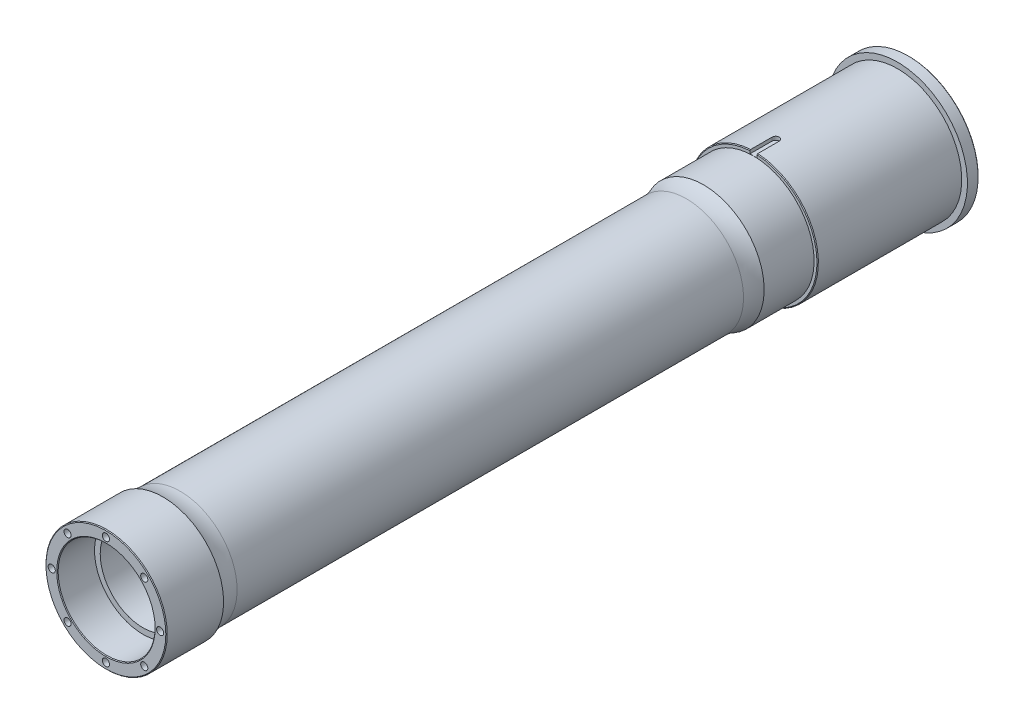
from build123d import *

# Parameters (mm, degrees)
SKETCH_3_R          = 2.5
CUT_EXTRUDE_1_DEPTH = 15
CUT_EXTRUDE_START   = -15
SKETCH_4_R          = 2.5
CUT_EXTRUDE_2_DEPTH = 15
CHAMFER_1_SIZE      = 0.5
CUT_EXTRUDE_3_DEPTH = 15


with BuildPart() as part:
    # 草图1 → 旋转1 (revolve)
    with BuildSketch(Plane(origin=(0, 0, 0), x_dir=(0, 0, -1), z_dir=(1, 0, 0)), mode=Mode.PRIVATE) as revolve_1_sk:
        with BuildLine():
            Line((0, 0), (0, 42.5))
            Line((0, 42.5), (40, 42.5))
            ThreePointArc((40, 42.5), (45.865854451, 40.631649689), (51.989578808, 40))
            Line((51.989578808, 40), (407.010421192, 40))
            ThreePointArc((407.010421192, 40), (413.134145549, 40.631649689), (419, 42.5))
            Line((419, 42.5), (454, 42.5))
            Line((454, 42.5), (454, 45))
            Line((454, 45), (555, 45))
            Line((555, 45), (555, 49))
            Line((555, 49), (563, 49))
            Line((563, 49), (563, 0))
            Line((563, 0), (0, 0))
        make_face()
    revolve(revolve_1_sk.sketch.rotate(Axis((0, 0, 0), (0, 0, 1)), 90), axis=Axis((0, 0, 0), (0, 0, 1)))

    # 草图2 → 切除-旋转1 (revolve, cut)
    with BuildSketch(Plane(origin=(0, 0, 0), x_dir=(0, 0, -1), z_dir=(1, 0, 0)), mode=Mode.PRIVATE) as cut_revolve_1_sk:
        Polygon((0, 0), (0, 34), (26, 34), (26, 30), (537, 30), (537, 34), (563, 34), (563, 0), align=None)
    revolve(cut_revolve_1_sk.sketch.rotate(Axis((0, 0, 0), (0, 0, 1)), 90), axis=Axis((0, 0, 0), (0, 0, 1)), mode=Mode.SUBTRACT)

    # 草图3 → 切除-拉伸1 (cut)
    with BuildSketch(Plane.XY):
        with Locations((0, 38)):
            Circle(SKETCH_3_R)
        with Locations((26.870057685, 26.870057685)):
            Circle(SKETCH_3_R)
        with Locations((38, 0)):
            Circle(SKETCH_3_R)
        with Locations((26.870057685, -26.870057685)):
            Circle(SKETCH_3_R)
        with Locations((0, -38)):
            Circle(SKETCH_3_R)
        with Locations((-26.870057685, -26.870057685)):
            Circle(SKETCH_3_R)
        with Locations((-38, 0)):
            Circle(SKETCH_3_R)
        with Locations((-26.870057685, 26.870057685)):
            Circle(SKETCH_3_R)
    extrude(amount=-CUT_EXTRUDE_1_DEPTH, mode=Mode.SUBTRACT)

    # 草图4 → 切除-拉伸2 (cut)
    with BuildSketch(Plane(origin=(0, 0, -563), x_dir=(-1, 0, 0), z_dir=(0, 0, -1)).offset(CUT_EXTRUDE_START)):
        with Locations(Location((0, 38, 0), (0, 0, 180))):
            Circle(SKETCH_4_R)
        with Locations(Location((26.870057685, 26.870057685, 0), (0, 0, 180))):
            Circle(SKETCH_4_R)
        with Locations(Location((38, 0, 0), (0, 0, 180))):
            Circle(SKETCH_4_R)
        with Locations(Location((26.870057685, -26.870057685, 0), (0, 0, 180))):
            Circle(SKETCH_4_R)
        with Locations(Location((0, -38, 0), (0, 0, 180))):
            Circle(SKETCH_4_R)
        with Locations(Location((-26.870057685, -26.870057685, 0), (0, 0, 180))):
            Circle(SKETCH_4_R)
        with Locations(Location((-38, 0, 0), (0, 0, 180))):
            Circle(SKETCH_4_R)
        with Locations(Location((-26.870057685, 26.870057685, 0), (0, 0, 180))):
            Circle(SKETCH_4_R)
    extrude(amount=CUT_EXTRUDE_2_DEPTH, mode=Mode.SUBTRACT)

    # 倒角1
    chamfer_1_edges = [part.edges().sort_by_distance(p)[0] for p in [
        (45, 0, -454),
        (49, 0, -563),
        (34, 0, 0),
        (34, 0, -563),
        (42.5, 0, 0),
    ]]
    chamfer(chamfer_1_edges, length=CHAMFER_1_SIZE)

    # 草图5 → 切除-拉伸3 (cut)
    with BuildSketch(Plane(origin=(0, 42.5, 0), x_dir=(1, 0, 0), z_dir=(0, 1, 0))):
        with BuildLine():
            Line((-2.5, 454), (-2.5, 469.5))
            ThreePointArc((-2.5, 469.5), (0, 472), (2.5, 469.5))
            Line((2.5, 469.5), (2.5, 454))
            Line((2.5, 454), (-2.5, 454))
        make_face()
    extrude(amount=CUT_EXTRUDE_3_DEPTH, mode=Mode.SUBTRACT)


solid = part.part
